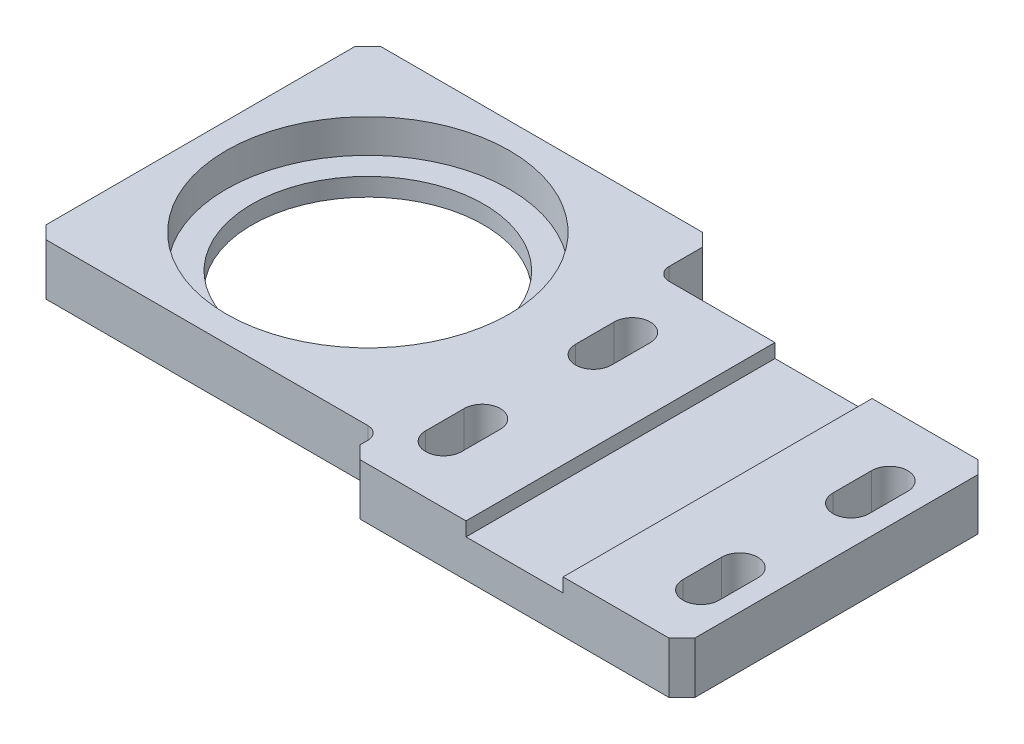
from build123d import *

# Parameters (mm, degrees)
EXTRUDE_1_DEPTH     = 20
SKETCH_3_R          = 45
CUT_EXTRUDE_1_DEPTH = 302.784691461
SKETCH_4_R          = 55
CUT_EXTRUDE_2_DEPTH = 13
SKETCH_5_W          = 37.703420814
SKETCH_5_H          = 120
CUT_EXTRUDE_3_DEPTH = 5.4
CUT_EXTRUDE_4_DEPTH = 302.784691461
FILLET_1_R          = 5
CHAMFER_1_SIZE      = 5


with BuildPart() as part:
    # 草图2 → 凸台-拉伸1 (new body)
    with BuildSketch(Plane(origin=(0, 0, 0), x_dir=(1, 0, 0), z_dir=(0, 1, 0))):
        Polygon((0, 0), (135, 0), (135, -23), (265, -23), (265, -143), (135, -143), (135, -130), (0, -130), align=None)
    extrude(amount=EXTRUDE_1_DEPTH)

    # 草图3 → 切除-拉伸1 (cut, through all)
    with BuildSketch(Plane(origin=(0, 20, 0), x_dir=(1, 0, 0), z_dir=(0, 1, 0))):
        with Locations(Location((65, -65, 0), (0, 0, 270))):
            Circle(SKETCH_3_R)
    extrude(amount=-CUT_EXTRUDE_1_DEPTH, mode=Mode.SUBTRACT)

    # 草图4 → 切除-拉伸2 (cut)
    with BuildSketch(Plane(origin=(0, 20, 0), x_dir=(1, 0, 0), z_dir=(0, 1, 0))):
        with Locations(Location((65, -65, 0), (0, 0, 270))):
            Circle(SKETCH_4_R)
    extrude(amount=-CUT_EXTRUDE_2_DEPTH, mode=Mode.SUBTRACT)

    # 草图5 → 切除-拉伸3 (cut)
    with BuildSketch(Plane(origin=(0, 20, 0), x_dir=(1, 0, 0), z_dir=(0, 1, 0))):
        with Locations((200, -83)):
            Rectangle(SKETCH_5_W, SKETCH_5_H)
    extrude(amount=-CUT_EXTRUDE_3_DEPTH, mode=Mode.SUBTRACT)

    # 草图6 → 切除-拉伸4 (cut, through all)
    with BuildSketch(Plane(origin=(0, 20, 0), x_dir=(1, 0, 0), z_dir=(0, 1, 0))):
        with BuildLine():
            Line((157, -47.312507702), (157, -62.312507702))
            ThreePointArc((157, -62.312507702), (150, -69.312507702), (143, -62.312507702))
            Line((143, -62.312507702), (143, -47.312507702))
            ThreePointArc((143, -47.312507702), (150, -40.312507702), (157, -47.312507702))
        make_face()
        with BuildLine():
            Line((157, -105.55824709), (157, -120.55824709))
            ThreePointArc((157, -120.55824709), (150, -127.55824709), (143, -120.55824709))
            Line((143, -120.55824709), (143, -105.55824709))
            ThreePointArc((143, -105.55824709), (150, -98.55824709), (157, -105.55824709))
        make_face()
        with BuildLine():
            Line((257, -47.312507702), (257, -62.312507702))
            ThreePointArc((257, -62.312507702), (250, -69.312507702), (243, -62.312507702))
            Line((243, -62.312507702), (243, -47.312507702))
            ThreePointArc((243, -47.312507702), (250, -40.312507702), (257, -47.312507702))
        make_face()
        with BuildLine():
            Line((257, -105.55824709), (257, -120.55824709))
            ThreePointArc((257, -120.55824709), (250, -127.55824709), (243, -120.55824709))
            Line((243, -120.55824709), (243, -105.55824709))
            ThreePointArc((243, -105.55824709), (250, -98.55824709), (257, -105.55824709))
        make_face()
    extrude(amount=-CUT_EXTRUDE_4_DEPTH, mode=Mode.SUBTRACT)

    # 圆角1
    fillet_1_edges = [part.edges().sort_by_distance(p)[0] for p in [
        (135, 10, 23),
        (135, 10, 130),
    ]]
    fillet(fillet_1_edges, radius=FILLET_1_R)

    # 倒角1
    chamfer_1_edges = [part.edges().sort_by_distance(p)[0] for p in [
        (0, 10, 0),
        (135, 10, 0),
        (265, 10, 23),
        (265, 10, 143),
        (135, 10, 143),
        (0, 10, 130),
    ]]
    chamfer(chamfer_1_edges, length=CHAMFER_1_SIZE)


solid = part.part
